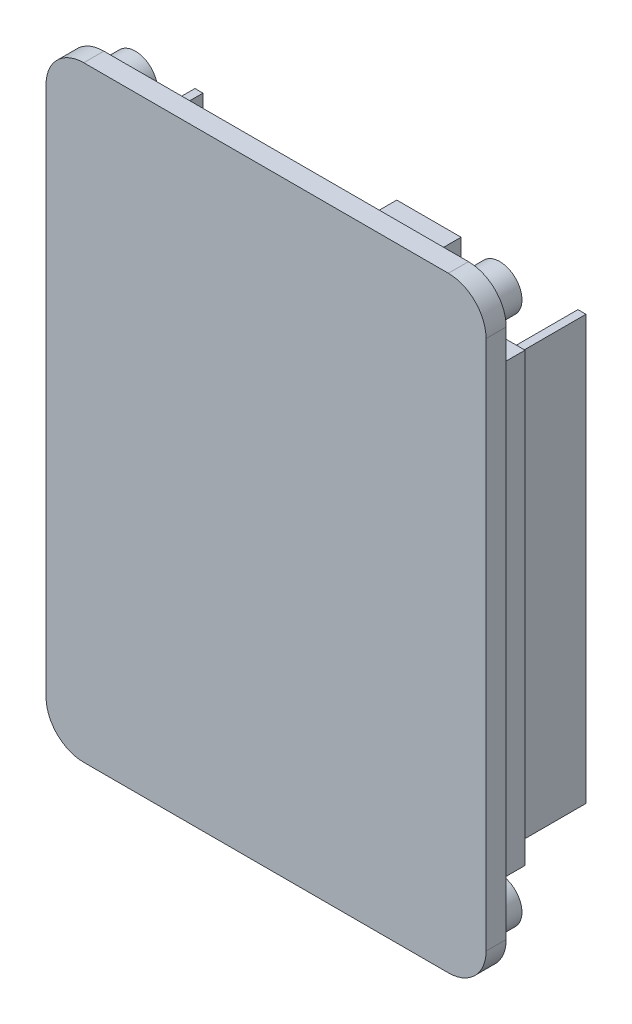
from build123d import *

# Parameters (mm, degrees)
PCB_DEPTH         = 1.6
HEADER_BODY_SK2_W = 2.54
HEADER_BODY_SK2_H = 35.52
HEADER_BODY_DEPTH = 2.5
HEADER_PINS_SK3_W = 0.64
HEADER_PINS_SK3_H = 33.72
HEADER_PINS_DEPTH = 5.8
STANDOFFS_SK4_R   = 1.765
STANDOFFS_DEPTH   = 2.5
M2_BORE_SK5_R     = 0.8
M2_BORE_DEPTH     = 3
USB_C_SK6_W       = 9.58
USB_C_SK6_H       = 7.71
USB_C_DEPTH       = 3.25
KEYS_SK7_W        = 4.56
KEYS_SK7_H        = 3.65
KEYS_DEPTH        = 1.81
CAM_FPC_SK8_W     = 17.2
CAM_FPC_SK8_H     = 5.69
CAM_FPC_DEPTH     = 2
BAT_CONN_SK9_W    = 7.65
BAT_CONN_SK9_H    = 5.2
BAT_CONN_DEPTH    = 3.4
TF_SLOT_SK10_W    = 11.4
TF_SLOT_SK10_H    = 5.5
TF_SLOT_DEPTH     = 2.7
ESP32_S3_SK11_W   = 5.12
ESP32_S3_SK11_H   = 14
ESP32_S3_DEPTH    = 1.8


with BuildPart() as part:
    # PCB_Sk1 → PCB (new body)
    with BuildSketch(Plane.XY.offset(-2)):
        with BuildLine():
            Line((-14.51, -25.81), (14.51, -25.81))
            ThreePointArc((14.51, -25.81), (16.631320344, -24.931320344), (17.51, -22.81))
            Line((17.51, -22.81), (17.51, 19.41))
            ThreePointArc((17.51, 19.41), (16.631320344, 21.531320344), (14.51, 22.41))
            Line((14.51, 22.41), (-14.51, 22.41))
            ThreePointArc((-14.51, 22.41), (-16.631320344, 21.531320344), (-17.51, 19.41))
            Line((-17.51, 19.41), (-17.51, -22.81))
            ThreePointArc((-17.51, -22.81), (-16.631320344, -24.931320344), (-14.51, -25.81))
        make_face()
    extrude(amount=-PCB_DEPTH)

    # Header_Body_Sk2 → Header_Body (add)
    with BuildSketch(Plane.XY.offset(-3.6)):
        with Locations((15.24, -1.7)):
            Rectangle(HEADER_BODY_SK2_W, HEADER_BODY_SK2_H)
        with Locations((-15.24, -1.7)):
            Rectangle(HEADER_BODY_SK2_W, HEADER_BODY_SK2_H)
    extrude(amount=-HEADER_BODY_DEPTH)

    # Header_Pins_Sk3 → Header_Pins (add)
    with BuildSketch(Plane.XY.offset(-6.1)):
        with Locations((15.24, -1.7)):
            Rectangle(HEADER_PINS_SK3_W, HEADER_PINS_SK3_H)
        with Locations((-15.24, -1.7)):
            Rectangle(HEADER_PINS_SK3_W, HEADER_PINS_SK3_H)
    extrude(amount=-HEADER_PINS_DEPTH)

    # Standoffs_Sk4 → Standoffs (add)
    with BuildSketch(Plane.XY.offset(-3.6)):
        with Locations((14.5, 19.4)):
            Circle(STANDOFFS_SK4_R)
        with Locations((-14.5, 19.4)):
            Circle(STANDOFFS_SK4_R)
        with Locations((14.5, -22.805)):
            Circle(STANDOFFS_SK4_R)
        with Locations((-14.5, -22.805)):
            Circle(STANDOFFS_SK4_R)
    extrude(amount=-STANDOFFS_DEPTH)

    # M2_Bore_Sk5 → M2_Bore (cut)
    with BuildSketch(Plane.XY.offset(-6.1)):
        with Locations((14.5, 19.4)):
            Circle(M2_BORE_SK5_R)
        with Locations((-14.5, 19.4)):
            Circle(M2_BORE_SK5_R)
        with Locations((14.5, -22.805)):
            Circle(M2_BORE_SK5_R)
        with Locations((-14.5, -22.805)):
            Circle(M2_BORE_SK5_R)
    extrude(amount=M2_BORE_DEPTH, mode=Mode.SUBTRACT)

    # USB_C_Sk6 → USB_C (add)
    with BuildSketch(Plane.XY.offset(-3.6)):
        with Locations((0, -23.135)):
            Rectangle(USB_C_SK6_W, USB_C_SK6_H)
    extrude(amount=-USB_C_DEPTH)

    # Keys_Sk7 → Keys (add)
    with BuildSketch(Plane.XY.offset(-3.6)):
        with Locations((9.475, -23.705)):
            Rectangle(KEYS_SK7_W, KEYS_SK7_H)
        with Locations((-9.45, -23.705)):
            Rectangle(KEYS_SK7_W, KEYS_SK7_H)
    extrude(amount=-KEYS_DEPTH)

    # Cam_FPC_Sk8 → Cam_FPC (add)
    with BuildSketch(Plane.XY.offset(-3.6)):
        with Locations((0, -12.475)):
            Rectangle(CAM_FPC_SK8_W, CAM_FPC_SK8_H)
    extrude(amount=-CAM_FPC_DEPTH)

    # Bat_Conn_Sk9 → Bat_Conn (add)
    with BuildSketch(Plane.XY.offset(-3.6)):
        with Locations((-9.095, -5.3)):
            Rectangle(BAT_CONN_SK9_W, BAT_CONN_SK9_H)
    extrude(amount=-BAT_CONN_DEPTH)

    # TF_Slot_Sk10 → TF_Slot (add)
    with BuildSketch(Plane.XY.offset(-3.6)):
        with Locations((-0.35, 4.25)):
            Rectangle(TF_SLOT_SK10_W, TF_SLOT_SK10_H)
    extrude(amount=-TF_SLOT_DEPTH)

    # ESP32_S3_Sk11 → ESP32_S3 (add)
    with BuildSketch(Plane.XY.offset(-3.6)):
        with Locations((9.56, 15)):
            Rectangle(ESP32_S3_SK11_W, ESP32_S3_SK11_H)
    extrude(amount=-ESP32_S3_DEPTH)


solid = part.part
